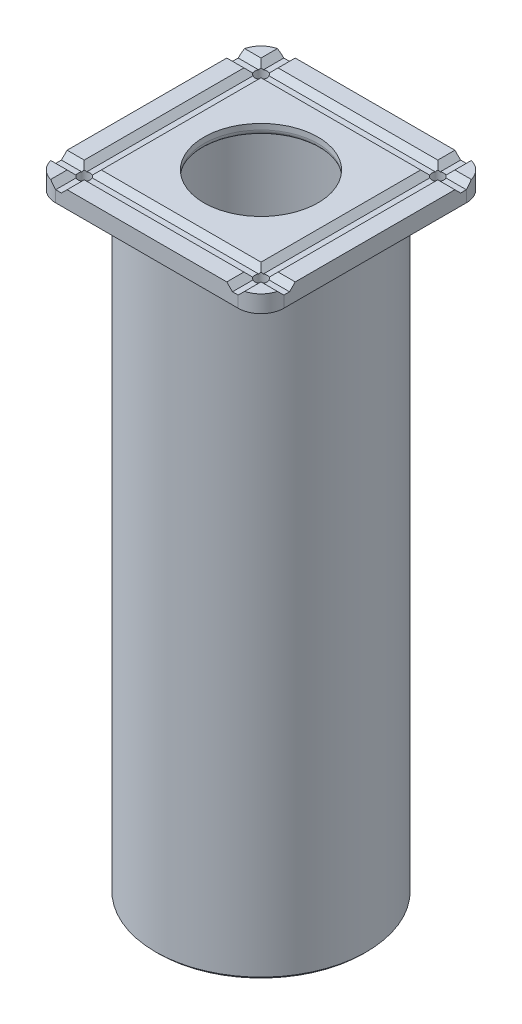
from build123d import *

# Parameters (mm, degrees)
SKETCH1_R                = 18.5
SKETCH1_R_2              = 16.5
BOSS_EXTRUDE1_DEPTH      = 108
SKETCH2_R                = 18.5
BOSS_EXTRUDE2_DEPTH      = 2
SKETCH3_R                = 10
CUT_EXTRUDE1_DEPTH       = 114.06856327
BOSS_EXTRUDE3_START      = -3
SKETCH4_W                = 40
SKETCH4_H                = 40
SKETCH4_R                = 18.5
BOSS_EXTRUDE3_DEPTH      = 3
FILLET1_R                = 4
CUT_EXTRUDE2_DEPTH       = 119.74342087
CIRPATTERN1_COUNT        = 2
CIRPATTERN1_ANGLE        = 90
CIRPATTERN1_COPY_1_DEPTH = 119.74342087
SKETCH6_R                = 1.05
CUT_EXTRUDE3_DEPTH       = 111.675200474
FILLET2_R                = 1
CHAMFER1_SIZE            = 0.5


with BuildPart() as part:
    # Sketch1 → Boss-Extrude1 (new body)
    with BuildSketch(Plane(origin=(0, 0, 0), x_dir=(1, 0, 0), z_dir=(0, 1, 0))):
        with Locations(Location((0, 0, 0), (0, 0, 270))):
            Circle(SKETCH1_R)
        with Locations(Location((0, 0, 0), (0, 0, 270))):
            Circle(SKETCH1_R_2, mode=Mode.SUBTRACT)
    extrude(amount=BOSS_EXTRUDE1_DEPTH)

    # Sketch2 → Boss-Extrude2 (add)
    with BuildSketch(Plane(origin=(0, 108, 0), x_dir=(1, 0, 0), z_dir=(0, 1, 0))):
        with Locations(Location((0, 0, 0), (0, 0, 270))):
            Circle(SKETCH2_R)
    extrude(amount=BOSS_EXTRUDE2_DEPTH)

    # Sketch3 → Cut-Extrude1 (cut, through all)
    with BuildSketch(Plane(origin=(0, 110, 0), x_dir=(1, 0, 0), z_dir=(0, 1, 0))):
        with Locations(Location((0, 0, 0), (0, 0, 270))):
            Circle(SKETCH3_R)
    extrude(amount=-CUT_EXTRUDE1_DEPTH, mode=Mode.SUBTRACT)

    # Sketch4 → Boss-Extrude3 (add)
    with BuildSketch(Plane(origin=(0, 110, 0), x_dir=(1, 0, 0), z_dir=(0, 1, 0)).offset(BOSS_EXTRUDE3_START)):
        Rectangle(SKETCH4_W, SKETCH4_H)
        with Locations(Location((0, 0, 0), (0, 0, 270))):
            Circle(SKETCH4_R, mode=Mode.SUBTRACT)
    extrude(amount=BOSS_EXTRUDE3_DEPTH)

    # Fillet1
    fillet1_edges = [part.edges().sort_by_distance(p)[0] for p in [
        (-20, 108.5, 20),
        (-20, 108.5, -20),
        (20, 108.5, -20),
        (20, 108.5, 20),
    ]]
    fillet(fillet1_edges, radius=FILLET1_R)

    # Sketch5 → Cut-Extrude2 (cut, through all)
    with BuildSketch(Plane.XY.offset(20)):
        Polygon((14, 110), (17, 110), (16, 109), (15, 109), align=None)
    cut_extrude2 = extrude(amount=-CUT_EXTRUDE2_DEPTH, mode=Mode.SUBTRACT)

    # Mirror1: Cut-Extrude2 across plane
    add(cut_extrude2.mirror(Plane(origin=(0, 0, 0), x_dir=(0, 0, 1), z_dir=(1, 0, 0))), mode=Mode.SUBTRACT)

    # CirPattern1: Cut-Extrude2 ×2 about axis
    cirpattern1_axis = Axis((0, 0, 0), (0, 1, 0))
    for i in range(1, CIRPATTERN1_COUNT):
        add(cut_extrude2.rotate(cirpattern1_axis, i * CIRPATTERN1_ANGLE / (CIRPATTERN1_COUNT - 1)), mode=Mode.SUBTRACT)

    # CirPattern1 copy 1 sketch → CirPattern1 copy 1 (cut, through all)
    with BuildSketch(Plane(origin=(20, 0, 0), x_dir=(0, 0, 1), z_dir=(1, 0, 0))):
        Polygon((14, -110), (17, -110), (16, -109), (15, -109), align=None)
    extrude(amount=-CIRPATTERN1_COPY_1_DEPTH, mode=Mode.SUBTRACT)

    # Sketch6 → Cut-Extrude3 (cut, through all)
    with BuildSketch(Plane.XZ.offset(-107)):
        with Locations(Location((15.5, 15.5, 0), (0, 0, 270))):
            Circle(SKETCH6_R)
        with Locations(Location((-15.5, 15.5, 0), (0, 0, 270))):
            Circle(SKETCH6_R)
        with Locations(Location((-15.5, -15.5, 0), (0, 0, 270))):
            Circle(SKETCH6_R)
        with Locations(Location((15.5, -15.5, 0), (0, 0, 270))):
            Circle(SKETCH6_R)
    extrude(amount=-CUT_EXTRUDE3_DEPTH, mode=Mode.SUBTRACT)

    # Fillet2
    fillet2_edges = [part.edges().sort_by_distance(p)[0] for p in [
        (0, 108, -10),
        (0, 107, -18.5),
    ]]
    fillet(fillet2_edges, radius=FILLET2_R)

    # Chamfer1
    chamfer1_edges = [part.edges().sort_by_distance(p)[0] for p in [
        (0, 0, -18.5),
        (0, 0, -16.5),
    ]]
    chamfer(chamfer1_edges, length=CHAMFER1_SIZE)


solid = part.part
